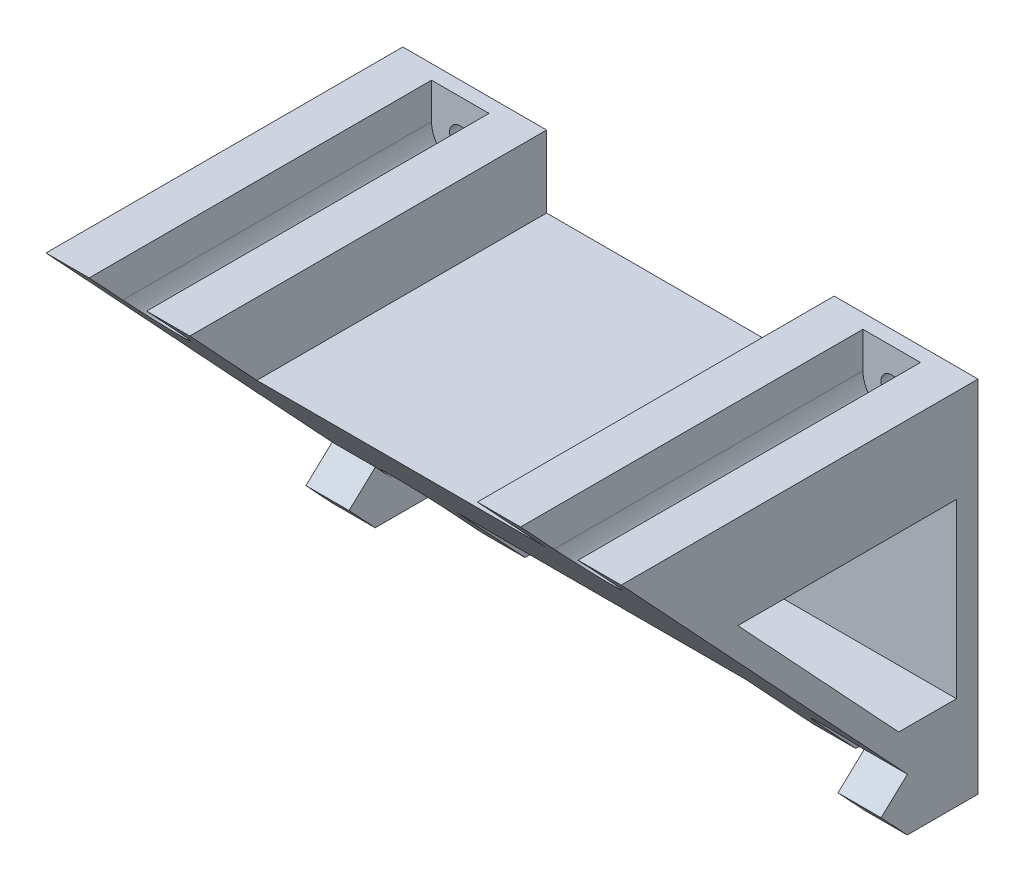
from build123d import *

# Parameters (mm, degrees)
EXTRUDE_2_DEPTH     = 2
SKETCH_3_R          = 1.5
CUT_EXTRUDE_1_DEPTH = 95.361008897
EXTRUDE_3_DEPTH     = 1
DRAFT_4_ANGLE       = 43
SKETCH_6_W          = 6
SKETCH_6_H          = 10
EXTRUDE_4_DEPTH     = 5
SKETCH_7_W          = 6
SKETCH_7_H          = 10
EXTRUDE_5_DEPTH     = 5
CUT_EXTRUDE_2_DEPTH = 107.596038813
CUT_EXTRUDE_4_DEPTH = 107.596038813


with BuildPart() as part:
    # 草图1 → 凸台-拉伸2 (new body)
    with BuildSketch(Plane.XY):
        Polygon((0, 0), (0, 50), (20, 50), (20, 40), (60, 40), (60, 50), (80, 50), (80, 0), (60, 0), (60, 10), (20, 10), (20, 0), align=None)
    extrude(amount=EXTRUDE_2_DEPTH)

    # 草图3 → 切除-拉伸1 (cut, through all)
    with BuildSketch(Plane.XY.offset(2)):
        with Locations((10, 45)):
            Circle(SKETCH_3_R)
        with Locations((10, 5)):
            Circle(SKETCH_3_R)
        with Locations((70, 45)):
            Circle(SKETCH_3_R)
        with Locations((70, 5)):
            Circle(SKETCH_3_R)
    extrude(amount=-CUT_EXTRUDE_1_DEPTH, mode=Mode.SUBTRACT)

    # 草图5 → 凸台-拉伸3 (add)
    with BuildSketch(Plane.XY.offset(2)):
        with BuildLine():
            Line((0, 50), (6, 50))
            Line((6, 50), (6, 45))
            ThreePointArc((6, 45), (10, 41), (14, 45))
            Line((14, 45), (14, 50))
            Line((14, 50), (20, 50))
            Line((20, 50), (20, 40))
            Line((20, 40), (60, 40))
            Line((60, 40), (60, 50))
            Line((60, 50), (66, 50))
            Line((66, 50), (66, 45))
            ThreePointArc((66, 45), (70, 41), (74, 45))
            Line((74, 45), (74, 50))
            Line((74, 50), (80, 50))
            Line((80, 50), (80, 0))
            Line((80, 0), (74, 0))
            Line((74, 0), (74, 5))
            ThreePointArc((74, 5), (70, 9), (66, 5))
            Line((66, 5), (66, 0))
            Line((66, 0), (60, 0))
            Line((60, 0), (60, 10))
            Line((60, 10), (20, 10))
            Line((20, 10), (20, 0))
            Line((20, 0), (14, 0))
            Line((14, 0), (14, 5))
            ThreePointArc((14, 5), (10, 9), (6, 5))
            Line((6, 5), (6, 0))
            Line((6, 0), (0, 0))
            Line((0, 0), (0, 50))
        make_face()
    extrude(amount=EXTRUDE_3_DEPTH)

    # 拔模4
    draft_4_faces = [part.faces().sort_by_distance(p)[0] for p in [
        (40, 25, 3),
    ]]
    draft(draft_4_faces, Plane(origin=(20, 0, 2), x_dir=(-1, 0, 0), z_dir=(0, -1, 0)), DRAFT_4_ANGLE)

    # 草图6 → 凸台-拉伸4 (add)
    with BuildSketch(Plane(origin=(0, -1.496346075, 1.604634711), x_dir=(1, 0, 0), z_dir=(0, -0.6819983600624997, 0.7313537016191695))):
        with Locations((3, 7.04599508)):
            Rectangle(SKETCH_6_W, SKETCH_6_H)
    extrude(amount=EXTRUDE_4_DEPTH)

    # 草图7 → 凸台-拉伸5 (add)
    with BuildSketch(Plane(origin=(0, -1.496346075, 1.604634711), x_dir=(1, 0, 0), z_dir=(0, -0.6819983600624997, 0.7313537016191695))):
        with Locations((77, 7.04599508)):
            Rectangle(SKETCH_7_W, SKETCH_7_H)
    extrude(amount=EXTRUDE_5_DEPTH)

    # 草图8 → 切除-拉伸2 (cut, through all)
    with BuildSketch(Plane(origin=(80, 0, 0), x_dir=(0, 0, -1), z_dir=(1, 0, 0))):
        Polygon((-3, 0), (-9.836637305, 0), (-6.656768508, -3.4099918), align=None)
    extrude(amount=-CUT_EXTRUDE_2_DEPTH, mode=Mode.SUBTRACT)

    # 草图11 → 切除-拉伸4 (cut, through all)
    with BuildSketch(Plane(origin=(80, 0, 0), x_dir=(0, 0, -1), z_dir=(1, 0, 0))):
        Polygon((-3, 37), (-3, 13), (-11.020713736, 13), (-33.401075804, 37), align=None)
    extrude(amount=-CUT_EXTRUDE_4_DEPTH, mode=Mode.SUBTRACT)


solid = part.part
